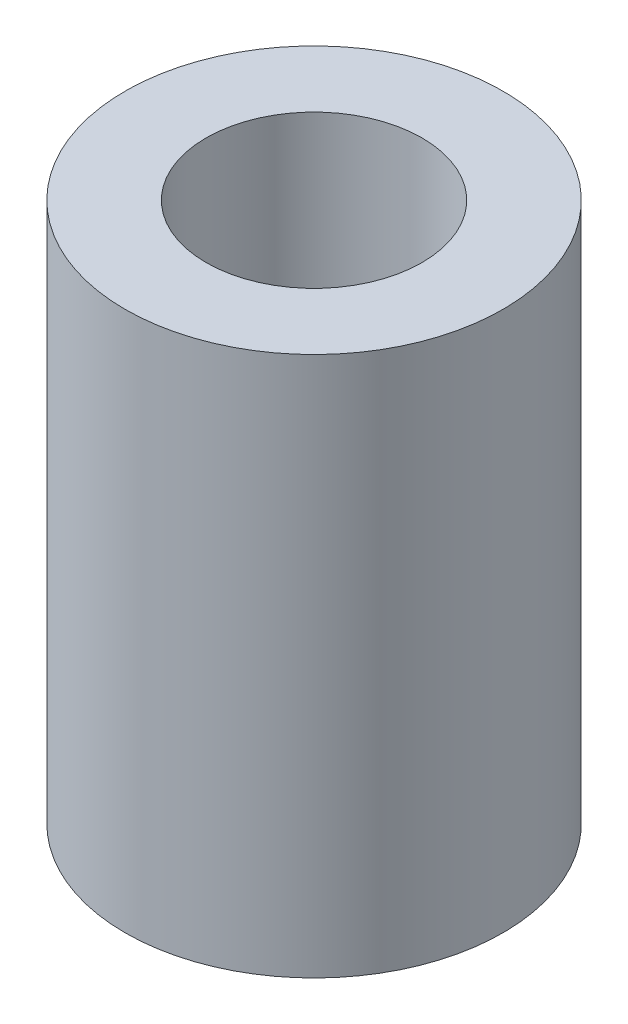
from build123d import *

# Parameters (mm, degrees)
SKETCH_1_R      = 1.75
SKETCH_1_R_2    = 1
EXTRUDE_1_DEPTH = 5


with BuildPart() as part:
    # 草图1 → 凸台-拉伸1 (new body)
    with BuildSketch(Plane(origin=(0, 0, 0), x_dir=(1, 0, 0), z_dir=(0, 1, 0))):
        with Locations(Location((0, 0, 0), (0, 0, 270))):
            Circle(SKETCH_1_R)
        with Locations(Location((0, 0, 0), (0, 0, 270))):
            Circle(SKETCH_1_R_2, mode=Mode.SUBTRACT)
    extrude(amount=EXTRUDE_1_DEPTH)


solid = part.part
